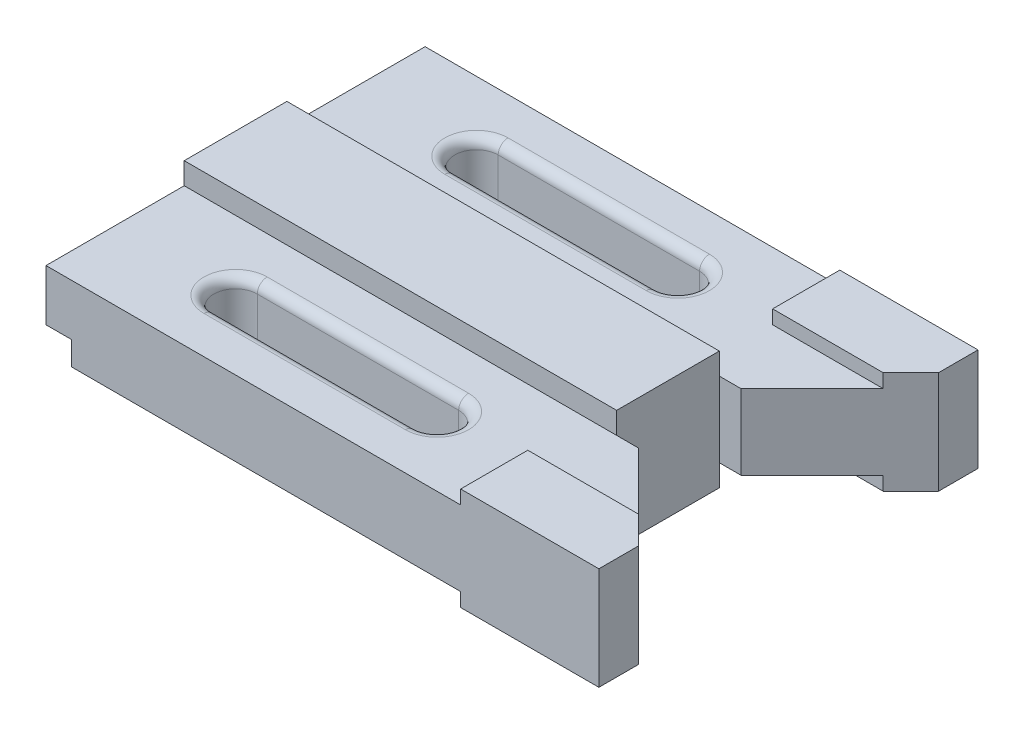
from build123d import *

# Parameters (mm, degrees)
BOSS_EXTRUDE3_DEPTH = 15
BOSS_EXTRUDE4_DEPTH = 9.5
BOSS_EXTRUDE5_DEPTH = 13
FILLET2_R           = 2.5
FILLET3_R           = 2.5
SKETCH2_W           = 6.5
SKETCH2_H           = 11.5
CUT_EXTRUDE1_DEPTH  = 171.414201286


with BuildPart() as part:
    # Sketch1 → Boss-Extrude3 (new, symmetric)
    with BuildSketch(Plane(origin=(0, 0, 0), x_dir=(1, 0, 0), z_dir=(0, 1, 0))):
        Polygon((0, 61), (0, 35), (109.5, 35), (109.5, 48), (109.5, 61), align=None)
    extrude(amount=BOSS_EXTRUDE3_DEPTH, both=True)

    # Sketch1<7> → Boss-Extrude4 (add, symmetric)
    # profile 1 of 2: a face of its own
    with BuildSketch(Plane(origin=(0, 0, 0), x_dir=(1, 0, 0), z_dir=(0, 1, 0))):
        Polygon((0, 35), (0, 0), (105, 0), (105, 17), (133, 17), (115, 35), align=None)
        with BuildLine():
            ThreePointArc((30.5, 12), (25, 17.5), (30.5, 23))
            Line((30.5, 23), (81.5, 23))
            ThreePointArc((81.5, 23), (87, 17.5), (81.5, 12))
            Line((81.5, 12), (30.5, 12))
        make_face(mode=Mode.SUBTRACT)
    # profile 2 of 2: a face of its own
    with BuildSketch(Plane(origin=(0, 0, 0), x_dir=(1, 0, 0), z_dir=(0, 1, 0))):
        Polygon((0, 96), (0, 61), (115, 61), (133, 79), (105, 79), (105, 96), align=None)
        with BuildLine():
            Line((81.5, 73), (30.5, 73))
            ThreePointArc((30.5, 73), (25, 78.5), (30.5, 84))
            Line((30.5, 84), (81.5, 84))
            ThreePointArc((81.5, 84), (87, 78.5), (81.5, 73))
        make_face(mode=Mode.SUBTRACT)
    extrude(amount=BOSS_EXTRUDE4_DEPTH, both=True)

    # Sketch1<8> → Boss-Extrude5 (add, symmetric)
    with BuildSketch(Plane(origin=(0, 0, 0), x_dir=(1, 0, 0), z_dir=(0, 1, 0))):
        Polygon((105, 17), (105, 0), (140, 0), (140, 10), (133, 17), align=None)
        Polygon((140, 96), (105, 96), (105, 79), (133, 79), (140, 86), align=None)
    extrude(amount=BOSS_EXTRUDE5_DEPTH, both=True)

    # Fillet2
    fillet2_edges = [part.edges().sort_by_distance(p)[0] for p in [
        (56, 9.5, -12),
        (56, -9.5, -12),
        (56, 9.5, -23),
        (56, -9.5, -23),
        (25, 9.5, -17.5),
        (25, -9.5, -17.5),
        (87, 9.5, -17.5),
        (87, -9.5, -17.5),
    ]]
    fillet(fillet2_edges, radius=FILLET2_R)

    # Fillet3
    fillet3_edges = [part.edges().sort_by_distance(p)[0] for p in [
        (56, 9.5, -84),
        (56, -9.5, -84),
        (56, 9.5, -73),
        (56, -9.5, -73),
        (87, 9.5, -78.5),
        (87, -9.5, -78.5),
        (25, 9.5, -78.5),
        (25, -9.5, -78.5),
    ]]
    fillet(fillet3_edges, radius=FILLET3_R)

    # Sketch2 → Cut-Extrude1 (cut, through all)
    with BuildSketch(Plane.XY):
        with Locations((3.25, -9.25)):
            Rectangle(SKETCH2_W, SKETCH2_H)
    extrude(amount=-CUT_EXTRUDE1_DEPTH, mode=Mode.SUBTRACT)


solid = part.part
